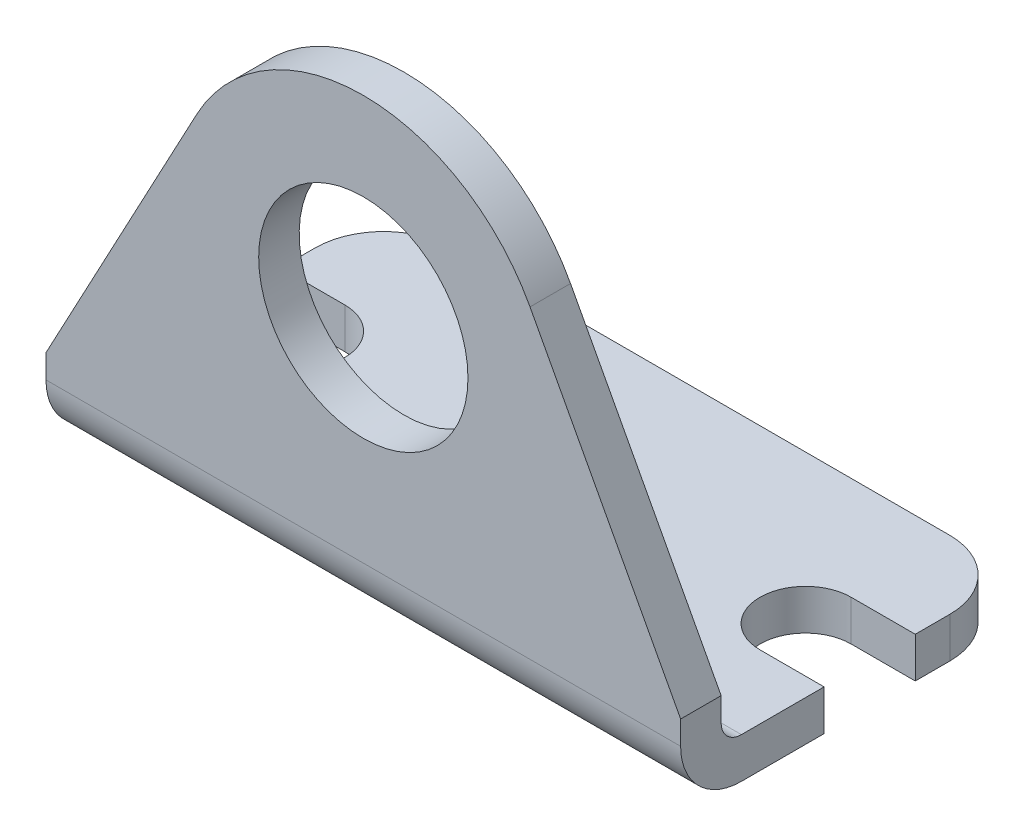
from build123d import *

# Parameters (mm, degrees)
BOSS_EXTRUDE1_DEPTH      = 14.224
BOSS_EXTRUDE1_DEPTH_BACK = 11.176
SKETCH3_R                = 7.874
CUT_EXTRUDE1_DEPTH       = 45.732854324
CUT_EXTRUDE2_DEPTH       = 61.919770059
FILLET1_R                = 5.1435


with BuildPart() as part:
    # Sketch3 → Boss-Extrude1 (new, two sides: drawn at the far end of the back side and taken through both)
    with BuildSketch(Plane.XY.offset(-BOSS_EXTRUDE1_DEPTH_BACK)):
        with BuildLine():
            Line((-23.876, 0), (23.876, 0))
            Line((23.876, 0), (23.876, 6.35))
            Line((23.876, 6.35), (12.542250985, 27.537256011))
            ThreePointArc((12.542250985, 27.537256011), (0, 35.052), (-12.542250985, 27.537256011))
            Line((-12.542250985, 27.537256011), (-23.876, 6.35))
            Line((-23.876, 6.35), (-23.876, 0))
        make_face()
        with Locations((0, 20.574)):
            Circle(SKETCH3_R, mode=Mode.SUBTRACT)
    extrude(amount=BOSS_EXTRUDE1_DEPTH + BOSS_EXTRUDE1_DEPTH_BACK)

    # Sketch4 → Cut-Extrude1 (cut, through all)
    with BuildSketch(Plane(origin=(0, 0, 0), x_dir=(1, 0, 0), z_dir=(0, 1, 0))):
        with BuildLine():
            Line((-23.876, 3.429), (-23.876, -3.429))
            Line((-23.876, -3.429), (-19.05, -3.429))
            ThreePointArc((-19.05, -3.429), (-15.621, 0), (-19.05, 3.429))
            Line((-19.05, 3.429), (-23.876, 3.429))
        make_face()
        with BuildLine():
            Line((19.05, 3.429), (23.876, 3.429))
            Line((23.876, 3.429), (23.876, -3.429))
            Line((23.876, -3.429), (19.05, -3.429))
            ThreePointArc((19.05, -3.429), (15.621, 0), (19.05, 3.429))
        make_face()
    extrude(amount=CUT_EXTRUDE1_DEPTH, mode=Mode.SUBTRACT)

    # Sketch5 → Cut-Extrude2 (cut, through all)
    with BuildSketch(Plane.ZY.offset(23.876)):
        with BuildLine():
            Line((-11.176, 35.052), (11.176, 35.052))
            Line((11.176, 35.052), (11.176, 4.572))
            ThreePointArc((11.176, 4.572), (10.729630735, 3.494369265), (9.652, 3.048))
            Line((9.652, 3.048), (-11.176, 3.048))
            Line((-11.176, 3.048), (-11.176, 35.052))
        make_face()
        with BuildLine():
            Line((9.652, 0), (14.224, 0))
            Line((14.224, 0), (14.224, 4.572))
            ThreePointArc((14.224, 4.572), (12.884892204, 1.339107796), (9.652, 0))
        make_face()
    extrude(amount=-CUT_EXTRUDE2_DEPTH, mode=Mode.SUBTRACT)

    # Fillet1
    fillet1_edges = [part.edges().sort_by_distance(p)[0] for p in [
        (23.876, 1.524, -11.176),
        (-23.876, 1.524, -11.176),
    ]]
    fillet(fillet1_edges, radius=FILLET1_R)


solid = part.part
